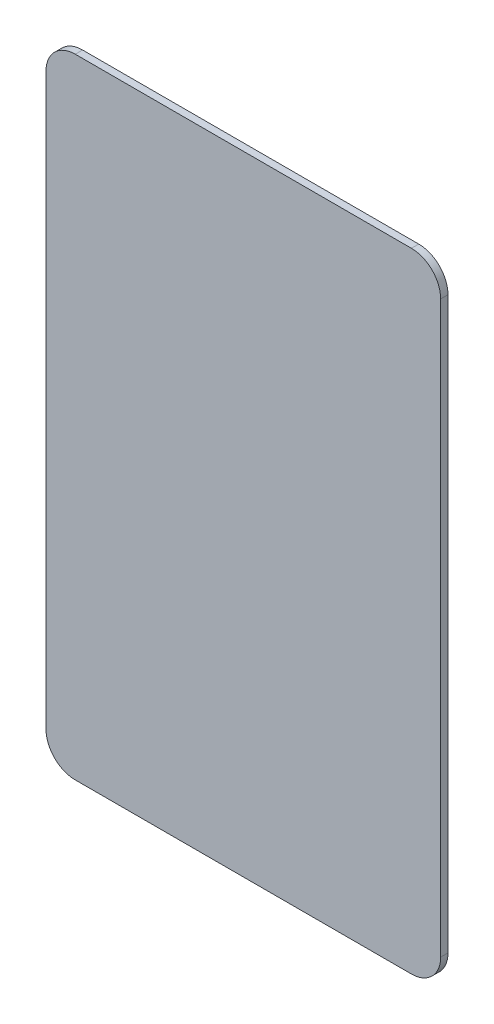
from build123d import *

# Parameters (mm, degrees)
SKETCH1_W           = 54
SKETCH1_H           = 86
BOSS_EXTRUDE1_DEPTH = 1
FILLET1_R           = 4


with BuildPart() as part:
    # Sketch1 → Boss-Extrude1 (new body)
    with BuildSketch(Plane.XY):
        Rectangle(SKETCH1_W, SKETCH1_H)
    extrude(amount=BOSS_EXTRUDE1_DEPTH)

    # Fillet1
    fillet1_edges = [part.edges().sort_by_distance(p)[0] for p in [
        (27, -43, 0.5),
        (-27, -43, 0.5),
        (-27, 43, 0.5),
        (27, 43, 0.5),
    ]]
    fillet(fillet1_edges, radius=FILLET1_R)


solid = part.part
